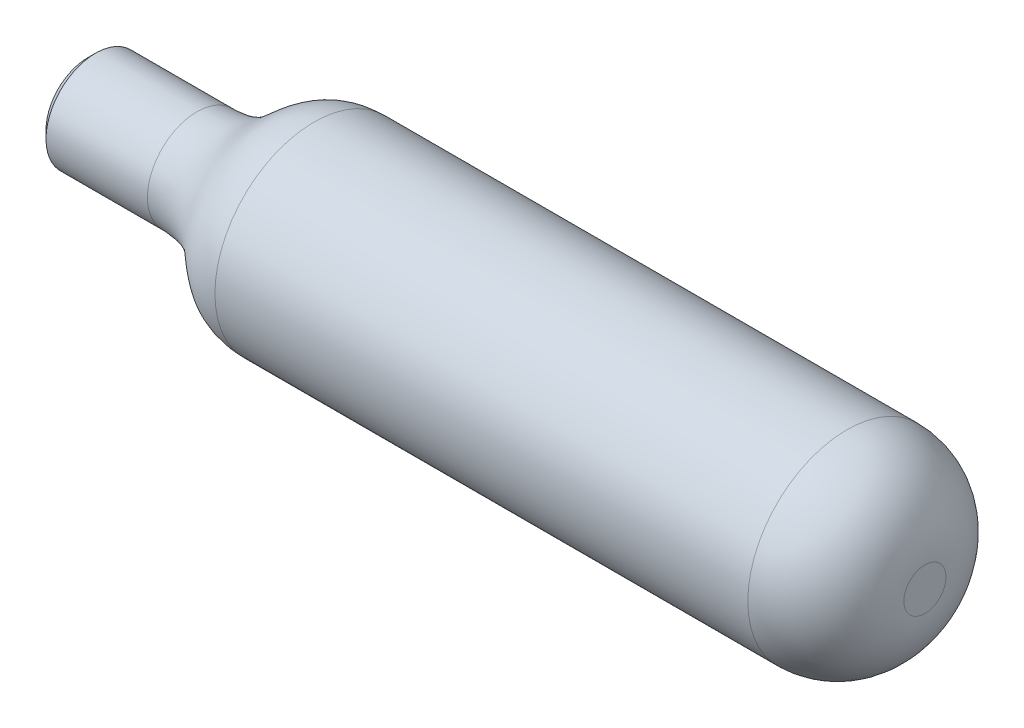
from build123d import *


with BuildPart() as part:
    # revolution body → Revolve1 (revolve)
    with BuildSketch(Plane.XY, mode=Mode.PRIVATE) as revolve1_sk:
        with BuildLine():
            Line((-67.034317062, 8.819371739), (-54.034317062, 8.819371739))
            add(Edge.make_bspline(
                [(-54.034317062, 8.819371739), (-45.639917935, 8.716149455), (-46.425076057, 15.031715968), (-39.034317062, 15.169371739)],
                knots=[0, 0, 0, 0, 1, 1, 1, 1], degree=3))
            Line((-39.034317062, 15.169371739), (29.265682938, 15.169371739))
            ThreePointArc((29.265682938, 15.169371739), (36.33675075, 12.24043955), (39.265682938, 5.169371739))
            Line((39.265682938, 5.169371739), (39.265682938, 2.469371739))
            Line((39.265682938, 2.469371739), (-68.034317062, 2.469371739))
            Line((-68.034317062, 2.469371739), (-68.034317062, 7.819371739))
            Line((-68.034317062, 7.819371739), (-67.034317062, 8.819371739))
        make_face()
    revolve(revolve1_sk.sketch.rotate(Axis((-68.034317062, 2.469371739, 0), (1, 0, 0)), 90), axis=Axis((-68.034317062, 2.469371739, 0), (1, 0, 0)))


solid = part.part
